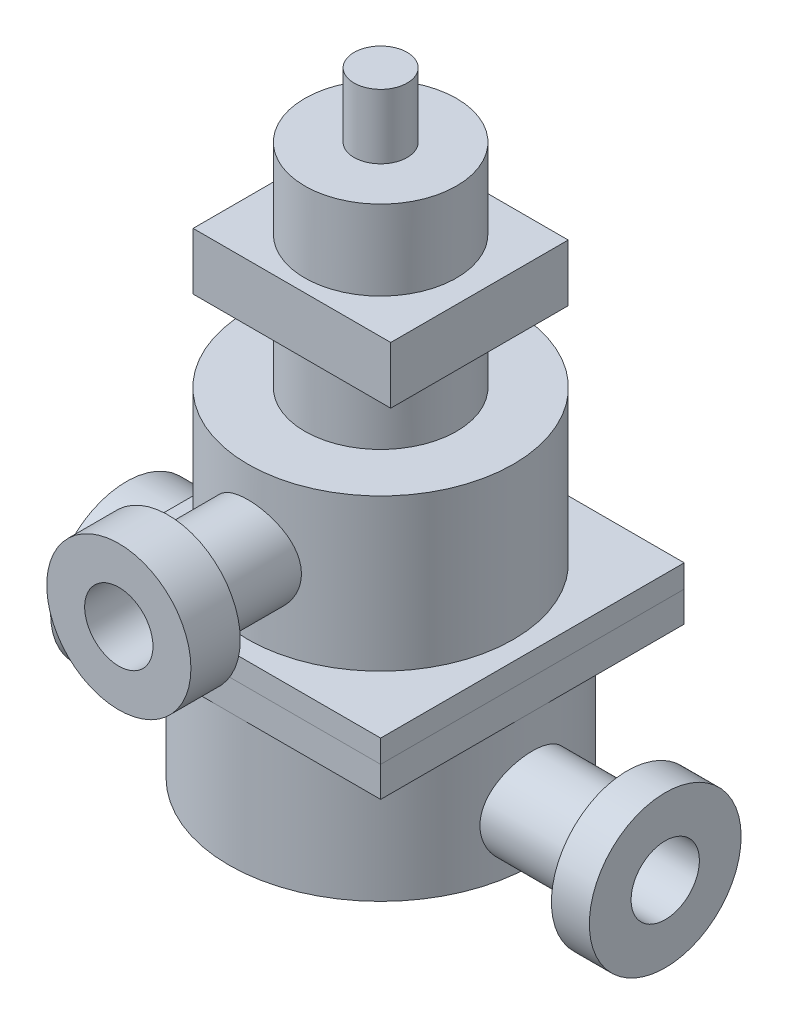
from build123d import *

# Parameters (mm, degrees)
SKETCH1_R                = 40
BOSS_EXTRUDE1_DEPTH      = 35
BOSS_EXTRUDE2_DEPTH      = 65
BOSS_EXTRUDE2_DEPTH_BACK = 54
SKETCH2_R                = 12
SKETCH3_R                = 20
BOSS_EXTRUDE3_DEPTH      = 10
BOSS_EXTRUDE4_DEPTH      = 8
SKETCH8_W                = 80
SKETCH8_H                = 80
BOSS_EXTRUDE5_DEPTH      = 6
SKETCH9_R                = 35
BOSS_EXTRUDE6_DEPTH      = 40
SKETCH10_R               = 20
BOSS_EXTRUDE7_DEPTH      = 56
SKETCH13_W               = 52.083997036
SKETCH13_H               = 46.768122186
BOSS_EXTRUDE8_DEPTH      = 15
SKETCH14_R               = 12
BOSS_EXTRUDE9_DEPTH      = 56
SKETCH15_R               = 19
BOSS_EXTRUDE10_DEPTH     = 13
SKETCH21_R               = 7
BOSS_EXTRUDE12_DEPTH     = 17
BOSS_EXTRUDE11_START     = 13
SKETCH18_R               = 20
BOSS_EXTRUDE11_DEPTH     = 13
SKETCH20_R               = 9
CUT_EXTRUDE3_DEPTH       = 37
CUT_EXTRUDE2_START       = -159
SKETCH4_R                = 9
CUT_EXTRUDE2_DEPTH       = 159
SKETCH16_R               = 9
CUT_EXTRUDE4_DEPTH       = 70


with BuildPart() as part:
    # Sketch1 → Boss-Extrude1 (new body)
    with BuildSketch(Plane(origin=(0, 0, 0), x_dir=(1, 0, 0), z_dir=(0, 1, 0))):
        with Locations(Location((0, 0, 0), (0, 0, 270))):
            Circle(SKETCH1_R)
    extrude(amount=BOSS_EXTRUDE1_DEPTH)

    # Sketch2 → Boss-Extrude2 (add, two sides: drawn at the far end of the back side and taken through both)
    with BuildSketch(Plane(origin=(0, 0, 0), x_dir=(0, 0, -1), z_dir=(1, 0, 0)).offset(-BOSS_EXTRUDE2_DEPTH_BACK)):
        with Locations((0, 14.062144172)):
            Circle(SKETCH2_R)
    extrude(amount=BOSS_EXTRUDE2_DEPTH + BOSS_EXTRUDE2_DEPTH_BACK)

    # Sketch3 → Boss-Extrude3 (add)
    with BuildSketch(Plane(origin=(65, 0, 0), x_dir=(0, 0, -1), z_dir=(1, 0, 0))):
        with Locations((0, 14.062144172)):
            Circle(SKETCH3_R)
    extrude(amount=BOSS_EXTRUDE3_DEPTH)

    # Sketch6 → Boss-Extrude4 (add)
    with BuildSketch(Plane(origin=(0, 35, 0), x_dir=(1, 0, 0), z_dir=(0, 1, 0))):
        Polygon((0, 40), (-40, 40), (-40, -40), (40, -40), (40, 40), align=None)
    extrude(amount=BOSS_EXTRUDE4_DEPTH)

    # Sketch18 → Boss-Extrude11 (add)
    with BuildSketch(Plane.ZY.offset(54).offset(BOSS_EXTRUDE11_START)):
        with Locations(Location((0, 14.062144172, 0), (0, 0, 180))):
            Circle(SKETCH18_R)
    extrude(amount=-BOSS_EXTRUDE11_DEPTH)

    # Sketch20 → Cut-Extrude3 (cut)
    with BuildSketch(Plane.ZY.offset(67)):
        with Locations((0, 14.062144172)):
            Circle(SKETCH20_R)
    extrude(amount=-CUT_EXTRUDE3_DEPTH, mode=Mode.SUBTRACT)

    # Sketch4 → Cut-Extrude2 (cut)
    with BuildSketch(Plane(origin=(75, 0, 0), x_dir=(0, 0, -1), z_dir=(1, 0, 0)).offset(CUT_EXTRUDE2_START)):
        with Locations(Location((0, 14.062144172, 0), (0, 0, 180))):
            Circle(SKETCH4_R)
    extrude(amount=CUT_EXTRUDE2_DEPTH, mode=Mode.SUBTRACT)


with BuildPart() as body_2:
    # Sketch8 → Boss-Extrude5 (new body)
    with BuildSketch(Plane(origin=(0, 43, 0), x_dir=(1, 0, 0), z_dir=(0, 1, 0))):
        Rectangle(SKETCH8_W, SKETCH8_H)
    extrude(amount=BOSS_EXTRUDE5_DEPTH)

    # Sketch9 → Boss-Extrude6 (add)
    with BuildSketch(Plane(origin=(0, 49, 0), x_dir=(1, 0, 0), z_dir=(0, 1, 0))):
        with Locations(Location((0, 0, 0), (0, 0, 270))):
            Circle(SKETCH9_R)
    extrude(amount=BOSS_EXTRUDE6_DEPTH)

    # Sketch10 → Boss-Extrude7 (add)
    with BuildSketch(Plane(origin=(0, 89, 0), x_dir=(1, 0, 0), z_dir=(0, 1, 0))):
        with Locations(Location((0, 0, 0), (0, 0, 270))):
            Circle(SKETCH10_R)
    extrude(amount=BOSS_EXTRUDE7_DEPTH)

    # Sketch13 → Boss-Extrude8 (add)
    with BuildSketch(Plane(origin=(0, 109, 0), x_dir=(1, 0, 0), z_dir=(0, 1, 0))):
        Rectangle(SKETCH13_W, SKETCH13_H)
    extrude(amount=BOSS_EXTRUDE8_DEPTH)

    # Sketch14 → Boss-Extrude9 (add)
    with BuildSketch(Plane.XY):
        with Locations(Location((0, 68.916575602, 0), (0, 0, 180))):
            Circle(SKETCH14_R)
    extrude(amount=BOSS_EXTRUDE9_DEPTH)

    # Sketch15 → Boss-Extrude10 (add)
    with BuildSketch(Plane.XY.offset(56)):
        with Locations((0, 68.916575602)):
            Circle(SKETCH15_R)
    extrude(amount=BOSS_EXTRUDE10_DEPTH)

    # Sketch21 → Boss-Extrude12 (add)
    with BuildSketch(Plane(origin=(0, 145, 0), x_dir=(1, 0, 0), z_dir=(0, 1, 0))):
        with Locations(Location((0, 0, 0), (0, 0, 270))):
            Circle(SKETCH21_R)
    extrude(amount=BOSS_EXTRUDE12_DEPTH)

    # Sketch16 → Cut-Extrude4 (cut)
    with BuildSketch(Plane.XY.offset(69)):
        with Locations((0, 68.916575602)):
            Circle(SKETCH16_R)
    extrude(amount=-CUT_EXTRUDE4_DEPTH, mode=Mode.SUBTRACT)


solid = Compound([part.part, body_2.part])
